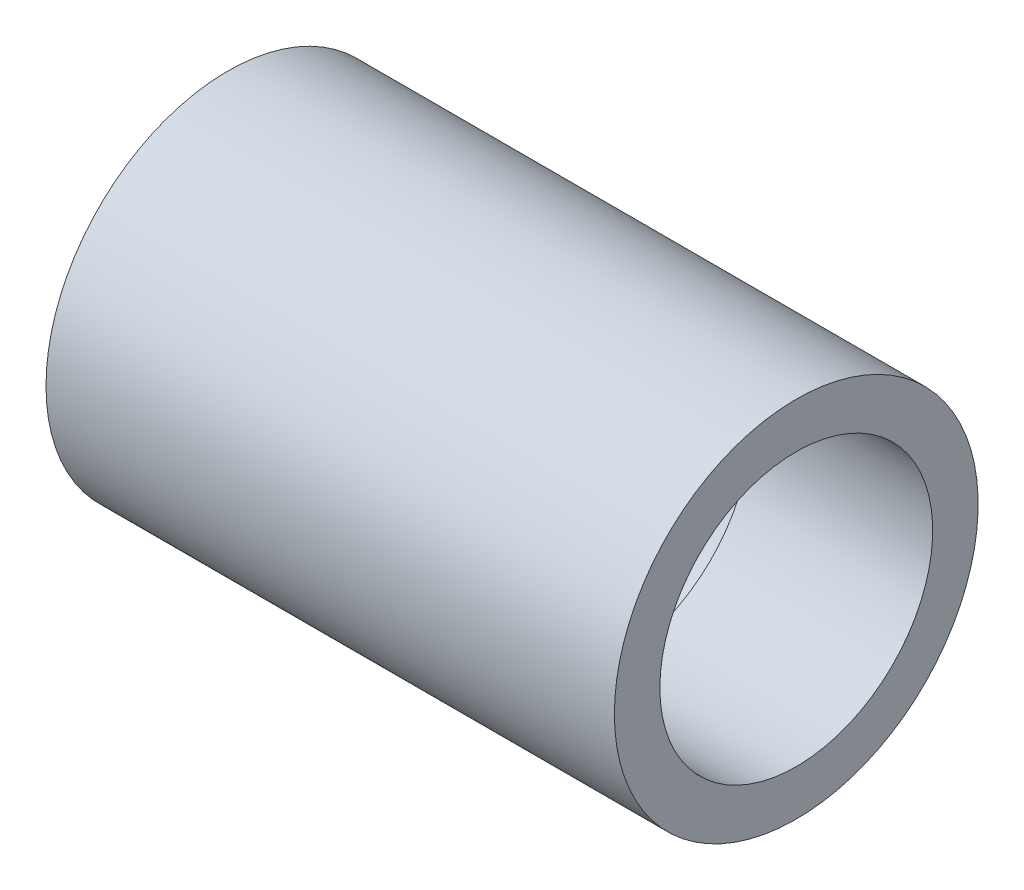
from build123d import *


with BuildPart() as part:
    # Esboço1 → Revolução1 (revolve)
    with BuildSketch(Plane.XY, mode=Mode.PRIVATE) as revolu_o1_sk:
        Polygon((-12.5, 6), (-4.5, 6), (-4.5, 6.5), (4.5, 6.5), (4.5, 6), (12.5, 6), (12.5, 8), (-12.5, 8), align=None)
    revolve(revolu_o1_sk.sketch.rotate(Axis((-6.257715372, 0, 0), (1, 0, 0)), 90), axis=Axis((-6.257715372, 0, 0), (1, 0, 0)))


solid = part.part
